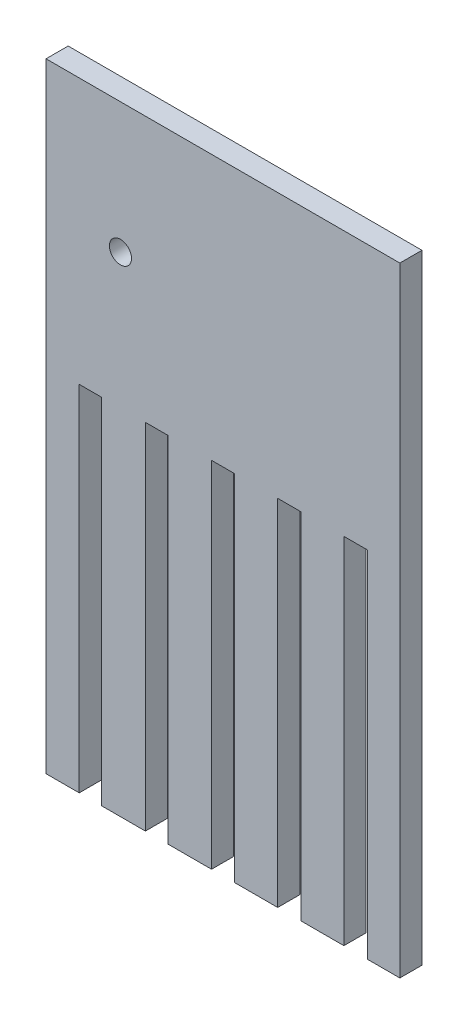
from build123d import *

# Parameters (mm, degrees)
SKETCH1_W           = 50.8
SKETCH1_H           = 88.9
SKETCH1_R           = 1.5875
BOSS_EXTRUDE1_DEPTH = 3.175
SKETCH2_W           = 3.175
SKETCH2_H           = 50.8
CUT_EXTRUDE1_DEPTH  = 52.293694788
LPATTERN1_COUNT     = 3
LPATTERN1_PITCH     = 9.525
LPATTERN1_COL_COUNT = 3
LPATTERN1_COL_PITCH = 9.525
CUT_EXTRUDE2_DEPTH  = 52.293694788


with BuildPart() as part:
    # Sketch1 → Boss-Extrude1 (new body)
    with BuildSketch(Plane.XY):
        Rectangle(SKETCH1_W, SKETCH1_H)
        with Locations((-14.715789726, 25.75263202)):
            Circle(SKETCH1_R, mode=Mode.SUBTRACT)
    extrude(amount=BOSS_EXTRUDE1_DEPTH)

    # Sketch2 → Cut-Extrude1 (cut, through all)
    with BuildSketch(Plane.XY.offset(3.175)):
        with Locations((0, -19.05)):
            Rectangle(SKETCH2_W, SKETCH2_H)
    cut_extrude1 = extrude(amount=-CUT_EXTRUDE1_DEPTH, mode=Mode.SUBTRACT)

    # LPattern1: Cut-Extrude1 ×3
    with Locations(*[(i * LPATTERN1_PITCH, 0, 0) for i in range(1, LPATTERN1_COUNT)]):
        add(cut_extrude1, mode=Mode.SUBTRACT)

    # LPattern1 col: Cut-Extrude1 ×3
    with Locations(*[(-i * LPATTERN1_COL_PITCH, 0, 0) for i in range(1, LPATTERN1_COL_COUNT)]):
        add(cut_extrude1, mode=Mode.SUBTRACT)

    # Sketch3 → Cut-Extrude2 (cut, through all)
    with BuildSketch(Plane.XY.offset(3.175)):
        Polygon((-11.1379, 6.3754), (-11.1379, -44.45), (-11.1125, -44.45), (-11.1125, 6.35), (-7.9375, 6.35), (-7.9375, -44.45), (-7.9121, -44.45), (-7.9121, 6.3754), align=None)
        Polygon((-1.6383, 6.4008), (-1.6383, -44.45), (-1.5875, -44.45), (-1.5875, 6.35), (1.5875, 6.35), (1.5875, -44.45), (1.6383, -44.45), (1.6383, 6.4008), align=None)
        Polygon((7.8613, 6.4262), (7.8613, -44.45), (7.9375, -44.45), (7.9375, 6.35), (11.1125, 6.35), (11.1125, -44.45), (11.1887, -44.45), (11.1887, 6.4262), align=None)
        Polygon((20.6375, -44.45), (20.7391, -44.45), (20.7391, 6.4516), (17.3609, 6.4516), (17.3609, -44.45), (17.4625, -44.45), (17.4625, 6.35), (20.6375, 6.35), align=None)
    extrude(amount=-CUT_EXTRUDE2_DEPTH, mode=Mode.SUBTRACT)


solid = part.part
